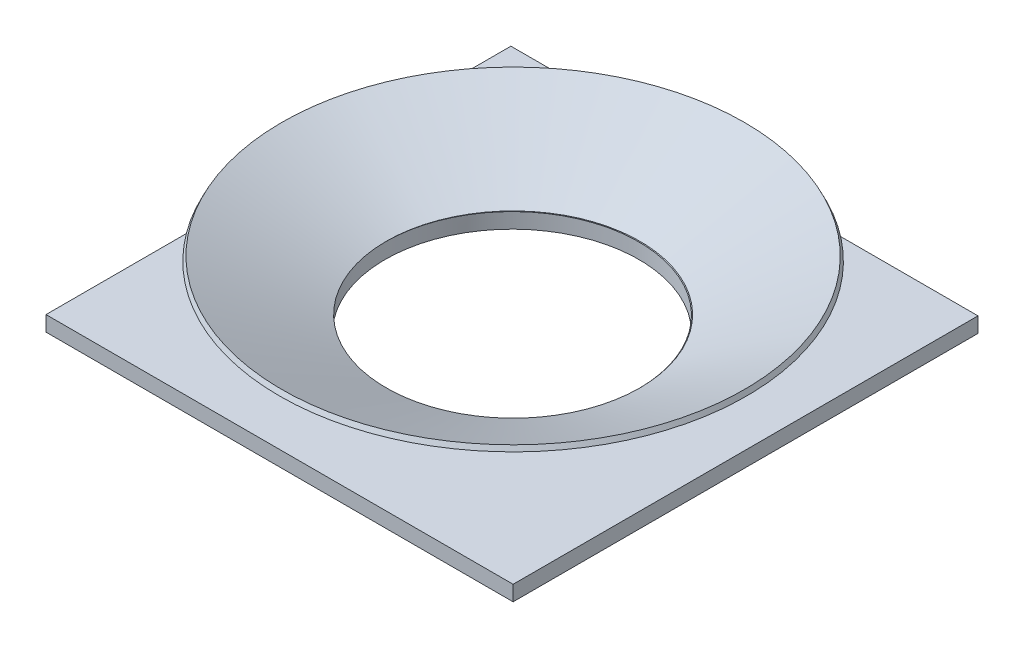
from build123d import *

# Parameters (mm, degrees)
SKETCH2_W           = 92
SKETCH2_H           = 91.562656452
SKETCH2_R           = 25
BOSS_EXTRUDE1_DEPTH = 3


with BuildPart() as part:
    # Sketch1 → Revolve1 (revolve)
    with BuildSketch(Plane.XY, mode=Mode.PRIVATE) as revolve1_sk:
        Polygon((-27.28653196, 0), (-46, 9.100705487), (-45.562656452, 10), (-25, 0), align=None)
    revolve(revolve1_sk.sketch.rotate(Axis((0, 0, 0), (0, 1, 0)), 270), axis=Axis((0, 0, 0), (0, 1, 0)))



with BuildPart() as body_2:
    # Sketch2 → Boss-Extrude1 (new body)
    with BuildSketch(Plane(origin=(0, 0, 0), x_dir=(1, 0, 0), z_dir=(0, 1, 0))):
        with Locations((0, -0.218671774)):
            Rectangle(SKETCH2_W, SKETCH2_H)
        with Locations(Location((0, -0.218671774, 0), (0, 0, 270))):
            Circle(SKETCH2_R, mode=Mode.SUBTRACT)
    extrude(amount=-BOSS_EXTRUDE1_DEPTH)


with BuildPart() as part_1:
    add(part.part)

    add(body_2.part)  # Revolve2 merges body 2
    # Sketch3 → Revolve2 (revolve)
    with BuildSketch(Plane.XY, mode=Mode.PRIVATE) as revolve2_sk:
        with BuildLine():
            Line((-27.28653196, 0), (-30.485609044, 1.555770331))
            ThreePointArc((-30.485609044, 1.555770331), (-30.045608993, 0.6353225), (-30.843850544, 0))
            Line((-30.843850544, 0), (-27.28653196, 0))
        make_face()
    revolve(revolve2_sk.sketch.rotate(Axis((0, 0, 0), (0, 1, 0)), 270), axis=Axis((0, 0, 0), (0, 1, 0)))


solid = part_1.part
